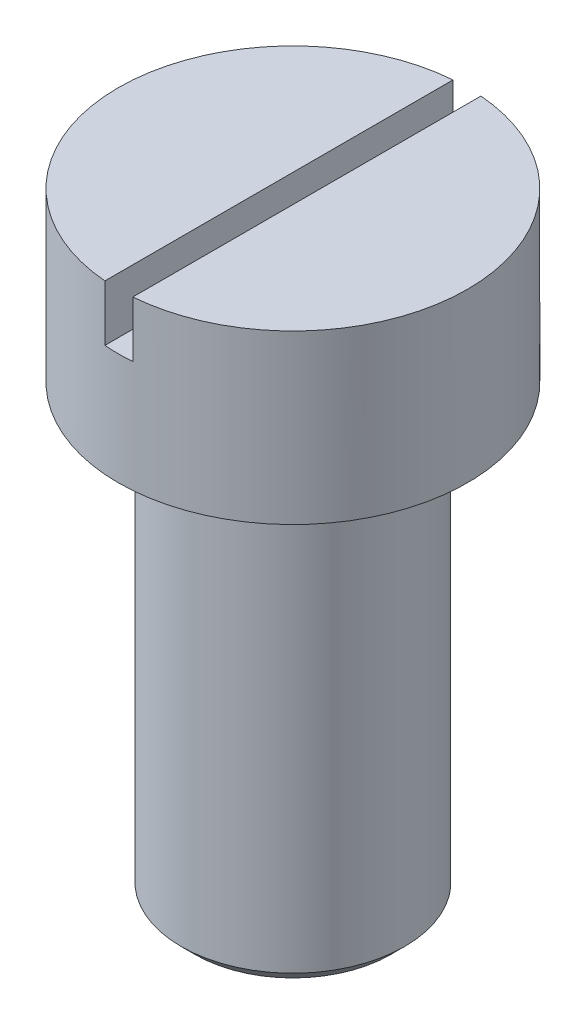
from build123d import *

# Parameters (mm, degrees)
IZIM3_R                     = 12.5
Y_KSEKLIK_EKSTR_ZYON1_DEPTH = 12
IZIM3_3_R                   = 8
Y_KSEKLIK_EKSTR_ZYON2_DEPTH = 32
PAH1_SIZE                   = 1
KES_EKSTR_ZYON1_DEPTH       = 48.418350878
KES_EKSTR_ZYON1_DEPTH_BACK  = 4
IZIM4_W                     = 2
IZIM4_H                     = 25


with BuildPart() as part:
    # Çizim3 → Yükseklik-Ekstrüzyon1 (new body)
    with BuildSketch(Plane(origin=(0, 0, 0), x_dir=(1, 0, 0), z_dir=(0, 1, 0))):
        Circle(IZIM3_R)
    extrude(amount=Y_KSEKLIK_EKSTR_ZYON1_DEPTH)

    # Çizim3<3> → Yükseklik-Ekstrüzyon2 (add)
    with BuildSketch(Plane(origin=(0, 0, 0), x_dir=(1, 0, 0), z_dir=(0, 1, 0))):
        Circle(IZIM3_3_R)
    extrude(amount=-Y_KSEKLIK_EKSTR_ZYON2_DEPTH)

    # Pah1
    pah1_edges = [part.edges().sort_by_distance(p)[0] for p in [
        (-8, -32, 0),
    ]]
    chamfer(pah1_edges, length=PAH1_SIZE)

    # Çizim4 → Kes-Ekstrüzyon1 (cut, two sides: drawn at the far end of the back side and taken through both)
    with BuildSketch(Plane(origin=(0, 12, 0), x_dir=(1, 0, 0), z_dir=(0, 1, 0)).offset(-KES_EKSTR_ZYON1_DEPTH_BACK)):
        Rectangle(IZIM4_W, IZIM4_H)
    extrude(amount=KES_EKSTR_ZYON1_DEPTH + KES_EKSTR_ZYON1_DEPTH_BACK, mode=Mode.SUBTRACT)


solid = part.part
